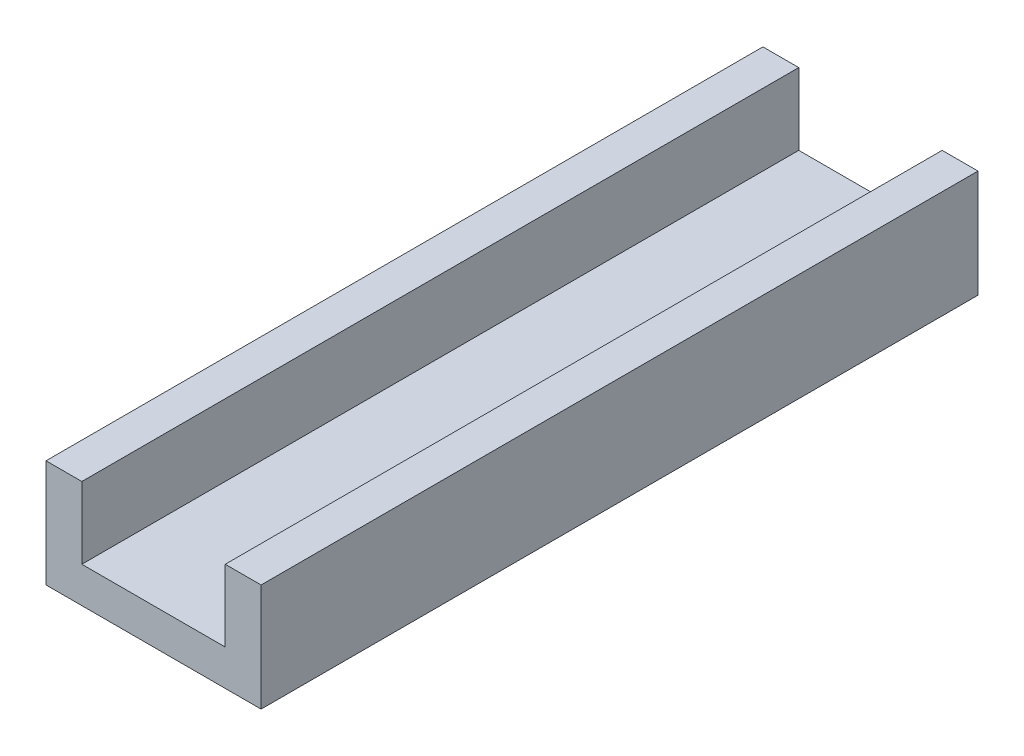
from build123d import *

# Parameters (mm, degrees)
EXTRUDE_THIN1_DEPTH = 200


with BuildPart() as part:
    # Sketch1 → Extrude-Thin1 (new body)
    with BuildSketch(Plane.XY):
        Polygon((0, 30), (0, 0), (60, 0), (60, 30), (50, 30), (50, 10), (10, 10), (10, 30), align=None)
    extrude(amount=EXTRUDE_THIN1_DEPTH)


solid = part.part
